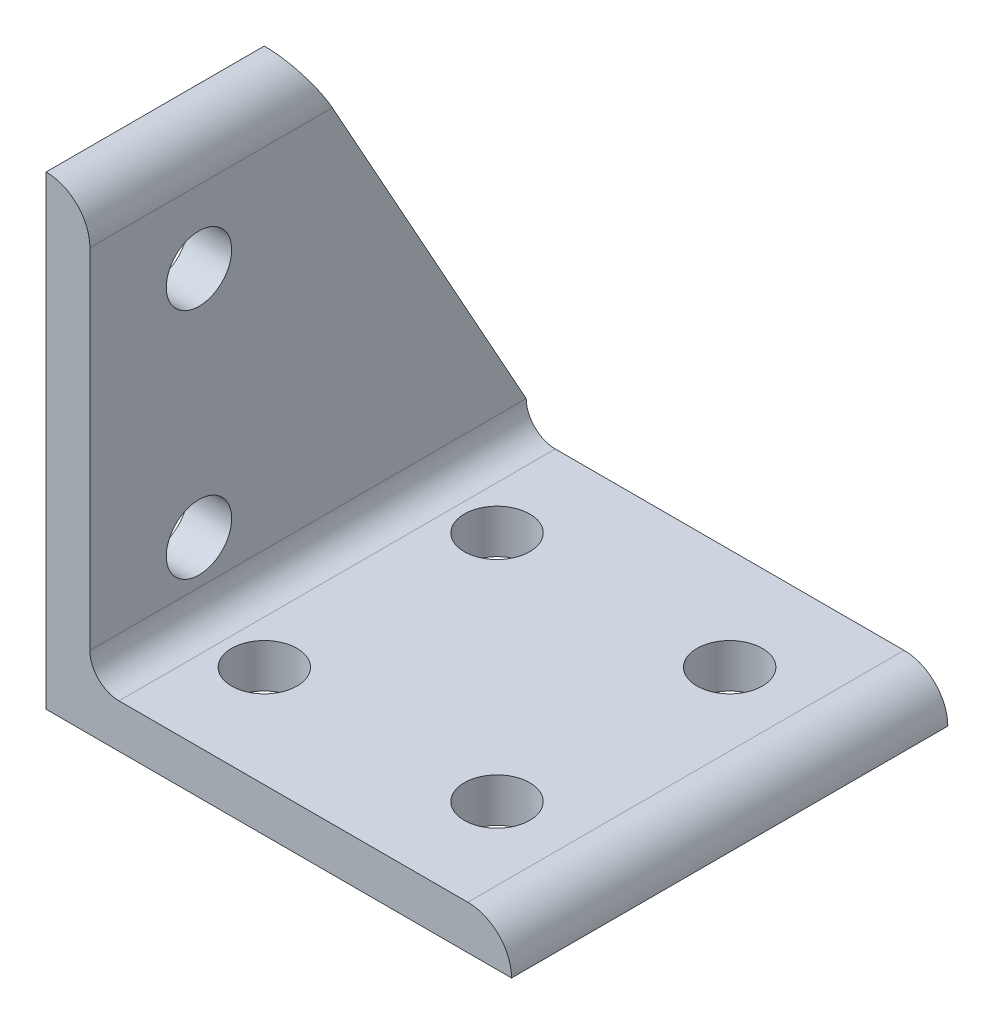
from build123d import *

# Parameters (mm, degrees)
BOSS_EXTRUDE1_DEPTH      = 23.8125
BOSS_EXTRUDE1_DEPTH_BACK = 23.8125
CUT_EXTRUDE1_DEPTH       = 58.710288262
CUT_EXTRUDE1_DEPTH_BACK  = 58.710288262
SKETCH6_R                = 3.5687
CUT_EXTRUDE2_DEPTH       = 58.710288262
SKETCH7_R                = 3.5687
CUT_EXTRUDE3_DEPTH       = 58.710288262


with BuildPart() as part:
    # Sketch4 → Boss-Extrude1 (new, two sides: drawn at the far end of the back side and taken through both)
    with BuildSketch(Plane.XY.offset(-BOSS_EXTRUDE1_DEPTH_BACK)):
        with BuildLine():
            Line((-25.4, 25.4), (-25.4, -25.4))
            Line((-25.4, -25.4), (25.4, -25.4))
            ThreePointArc((25.4, -25.4), (24.001376302, -22.023423698), (20.6248, -20.6248))
            Line((20.6248, -20.6248), (-17.4498, -20.6248))
            ThreePointArc((-17.4498, -20.6248), (-19.69486403, -19.69486403), (-20.6248, -17.4498))
            Line((-20.6248, -17.4498), (-20.6248, 20.6248))
            ThreePointArc((-20.6248, 20.6248), (-22.023423698, 24.001376302), (-25.4, 25.4))
        make_face()
    extrude(amount=BOSS_EXTRUDE1_DEPTH + BOSS_EXTRUDE1_DEPTH_BACK)

    # Sketch5 → Cut-Extrude1 (cut, two sides: drawn at the far end of the back side and taken through both)
    with BuildSketch(Plane(origin=(-20.6248, 0, 0), x_dir=(0, 0, -1), z_dir=(1, 0, 0)).offset(-CUT_EXTRUDE1_DEPTH_BACK)):
        Polygon((23.8125, 25.4), (0, 25.4), (23.8125, -17.4498), align=None)
    extrude(amount=CUT_EXTRUDE1_DEPTH + CUT_EXTRUDE1_DEPTH_BACK, mode=Mode.SUBTRACT)

    # Sketch6 → Cut-Extrude2 (cut, through all)
    with BuildSketch(Plane(origin=(-20.6248, 0, 0), x_dir=(0, 0, -1), z_dir=(1, 0, 0))):
        with Locations(Location((-11.90625, 12.7, 0), (0, 0, 90))):
            Circle(SKETCH6_R)
        with Locations(Location((-11.90625, -12.7, 0), (0, 0, 270))):
            Circle(SKETCH6_R)
    extrude(amount=-CUT_EXTRUDE2_DEPTH, mode=Mode.SUBTRACT)

    # Sketch7 → Cut-Extrude3 (cut, through all)
    with BuildSketch(Plane(origin=(0, -20.6248, 0), x_dir=(1, 0, 0), z_dir=(0, 1, 0))):
        with Locations(Location((-12.7, 12.7, 0), (0, 0, 180))):
            Circle(SKETCH7_R)
        with Locations(Location((12.7, 12.7, 0), (0, 0, 180))):
            Circle(SKETCH7_R)
        with Locations((12.7, -12.7)):
            Circle(SKETCH7_R)
        with Locations((-12.7, -12.7)):
            Circle(SKETCH7_R)
    extrude(amount=-CUT_EXTRUDE3_DEPTH, mode=Mode.SUBTRACT)


solid = part.part
